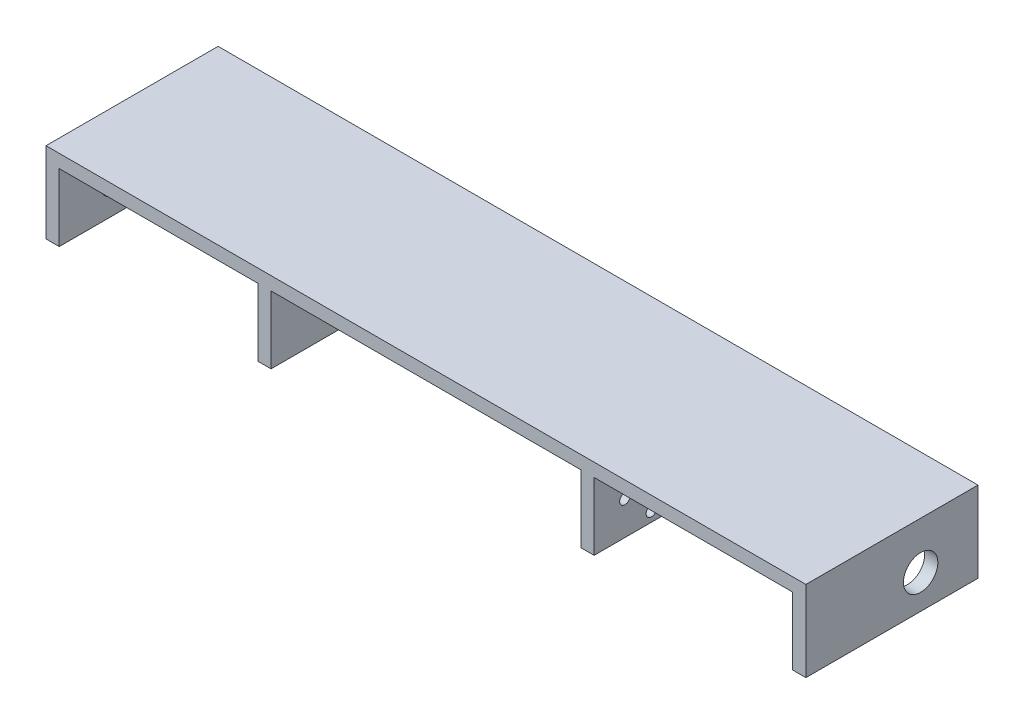
from build123d import *

# Parameters (mm, degrees)
SKETCH2_W           = 287
SKETCH2_H           = 65
BOSS_EXTRUDE1_DEPTH = 5
SKETCH4_W           = 5
SKETCH4_H           = 65
BOSS_EXTRUDE2_DEPTH = 25.5
SKETCH5_W           = 5
SKETCH5_H           = 65
BOSS_EXTRUDE3_DEPTH = 25.5
SKETCH6_W           = 5
SKETCH6_H           = 65
BOSS_EXTRUDE4_DEPTH = 25.5
SKETCH8_W           = 5
SKETCH8_H           = 65
BOSS_EXTRUDE5_DEPTH = 25.5
CUT_EXTRUDE1_REACH  = 299.556
SKETCH7_R           = 6.5
CUT_EXTRUDE2_REACH  = 299.556
SKETCH9_R           = 6.5
CUT_EXTRUDE3_REACH  = 223.403
SKETCH11_R          = 4.5
CUT_EXTRUDE4_REACH  = 223.403
SKETCH10_R          = 4.5
SKETCH14_W          = 1
SKETCH14_H          = 25.5
BOSS_EXTRUDE6_DEPTH = 1
CUT_EXTRUDE6_REACH  = 218.736
SKETCH15_R          = 2


with BuildPart() as part:
    # Sketch2 → Boss-Extrude1 (new body)
    with BuildSketch(Plane(origin=(0, 0, 0), x_dir=(1, 0, 0), z_dir=(0, 1, 0))):
        with Locations((100.827281974, 41.798134807)):
            Rectangle(SKETCH2_W, SKETCH2_H)
    extrude(amount=BOSS_EXTRUDE1_DEPTH)

    # Sketch4 → Boss-Extrude2 (add)
    with BuildSketch(Plane.XZ):
        with Locations((-40.172718026, -41.798134807)):
            Rectangle(SKETCH4_W, SKETCH4_H)
    extrude(amount=BOSS_EXTRUDE2_DEPTH)

    # Sketch5 → Boss-Extrude3 (add)
    with BuildSketch(Plane.XZ):
        with Locations((39.827281974, -41.798134807)):
            Rectangle(SKETCH5_W, SKETCH5_H)
    extrude(amount=BOSS_EXTRUDE3_DEPTH)

    # Sketch6 → Boss-Extrude4 (add)
    with BuildSketch(Plane.XZ):
        with Locations((241.827281974, -41.798134807)):
            Rectangle(SKETCH6_W, SKETCH6_H)
    extrude(amount=BOSS_EXTRUDE4_DEPTH)

    # Sketch8 → Boss-Extrude5 (add)
    with BuildSketch(Plane.XZ):
        with Locations((161.827281974, -41.798134807)):
            Rectangle(SKETCH8_W, SKETCH8_H)
    extrude(amount=BOSS_EXTRUDE5_DEPTH)

    # Sketch7 → Cut-Extrude1 (cut, up to next)
    with BuildSketch(Plane.ZY.offset(42.672718026), mode=Mode.PRIVATE) as cut_extrude1_sk1:
        with Locations((-30.964801474, -12.75)):
            Circle(SKETCH7_R)
    cut_extrude1_tool1 = extrude(cut_extrude1_sk1.sketch, amount=-CUT_EXTRUDE1_REACH, mode=Mode.PRIVATE) & part.part
    add(cut_extrude1_tool1.solids().sort_by_distance((-42.672718, -12.75, -30.964801))[0], mode=Mode.SUBTRACT)

    # Sketch9 → Cut-Extrude2 (cut, up to next)
    with BuildSketch(Plane(origin=(244.327281974, 0, 0), x_dir=(0, 0, -1), z_dir=(1, 0, 0)), mode=Mode.PRIVATE) as cut_extrude2_sk1:
        with Locations((52.631468141, -12.75)):
            Circle(SKETCH9_R)
    cut_extrude2_tool1 = extrude(cut_extrude2_sk1.sketch, amount=-CUT_EXTRUDE2_REACH, mode=Mode.PRIVATE) & part.part
    add(cut_extrude2_tool1.solids().sort_by_distance((244.327282, -12.75, -52.631468))[0], mode=Mode.SUBTRACT)

    # Sketch11 → Cut-Extrude3 (cut, up to next)
    with BuildSketch(Plane(origin=(164.327281974, 0, 0), x_dir=(0, 0, -1), z_dir=(1, 0, 0)), mode=Mode.PRIVATE) as cut_extrude3_sk1:
        with Locations((52.631468141, -12.75)):
            Circle(SKETCH11_R)
    cut_extrude3_tool1 = extrude(cut_extrude3_sk1.sketch, amount=-CUT_EXTRUDE3_REACH, mode=Mode.PRIVATE) & part.part
    add(cut_extrude3_tool1.solids().sort_by_distance((164.327282, -12.75, -52.631468))[0], mode=Mode.SUBTRACT)

    # Sketch10 → Cut-Extrude4 (cut, up to next)
    with BuildSketch(Plane.ZY.offset(-37.327281974), mode=Mode.PRIVATE) as cut_extrude4_sk1:
        with Locations((-30.964801474, -12.75)):
            Circle(SKETCH10_R)
    cut_extrude4_tool1 = extrude(cut_extrude4_sk1.sketch, amount=-CUT_EXTRUDE4_REACH, mode=Mode.PRIVATE) & part.part
    add(cut_extrude4_tool1.solids().sort_by_distance((37.327282, -12.75, -30.964801))[0], mode=Mode.SUBTRACT)

    # Sketch14 → Boss-Extrude6 (add)
    with BuildSketch(Plane.ZY.offset(-159.327281974)):
        with Locations((-15.468134807, -12.75)):
            Rectangle(SKETCH14_W, SKETCH14_H)
        with Locations((-46.468134807, -12.75)):
            Rectangle(SKETCH14_W, SKETCH14_H)
    extrude(amount=BOSS_EXTRUDE6_DEPTH)

    # Sketch15 → Cut-Extrude6 (cut, up to next)
    with BuildSketch(Plane.ZY.offset(-159.327281974), mode=Mode.PRIVATE) as cut_extrude6_sk1:
        with Locations((-20.968134807, -12.75)):
            Circle(SKETCH15_R)
    cut_extrude6_tool1 = extrude(cut_extrude6_sk1.sketch, amount=-CUT_EXTRUDE6_REACH, mode=Mode.PRIVATE) & part.part
    # Sketch15 → Cut-Extrude6 (cut, up to next)
    with BuildSketch(Plane.ZY.offset(-159.327281974), mode=Mode.PRIVATE) as cut_extrude6_sk2:
        with Locations((-40.968134807, -12.75)):
            Circle(SKETCH15_R)
    cut_extrude6_tool2 = extrude(cut_extrude6_sk2.sketch, amount=-CUT_EXTRUDE6_REACH, mode=Mode.PRIVATE) & part.part
    # Sketch15 → Cut-Extrude6 (cut, up to next)
    with BuildSketch(Plane.ZY.offset(-159.327281974), mode=Mode.PRIVATE) as cut_extrude6_sk3:
        with Locations((-30.968134807, -21.75)):
            Circle(SKETCH15_R)
    cut_extrude6_tool3 = extrude(cut_extrude6_sk3.sketch, amount=-CUT_EXTRUDE6_REACH, mode=Mode.PRIVATE) & part.part
    # Sketch15 → Cut-Extrude6 (cut, up to next)
    with BuildSketch(Plane.ZY.offset(-159.327281974), mode=Mode.PRIVATE) as cut_extrude6_sk4:
        with Locations((-30.968134807, -3.75)):
            Circle(SKETCH15_R)
    cut_extrude6_tool4 = extrude(cut_extrude6_sk4.sketch, amount=-CUT_EXTRUDE6_REACH, mode=Mode.PRIVATE) & part.part
    add(cut_extrude6_tool1.solids().sort_by_distance((159.327282, -12.75, -20.968135))[0], mode=Mode.SUBTRACT)
    add(cut_extrude6_tool2.solids().sort_by_distance((159.327282, -12.75, -40.968135))[0], mode=Mode.SUBTRACT)
    add(cut_extrude6_tool3.solids().sort_by_distance((159.327282, -21.75, -30.968135))[0], mode=Mode.SUBTRACT)
    add(cut_extrude6_tool4.solids().sort_by_distance((159.327282, -3.75, -30.968135))[0], mode=Mode.SUBTRACT)


solid = part.part
